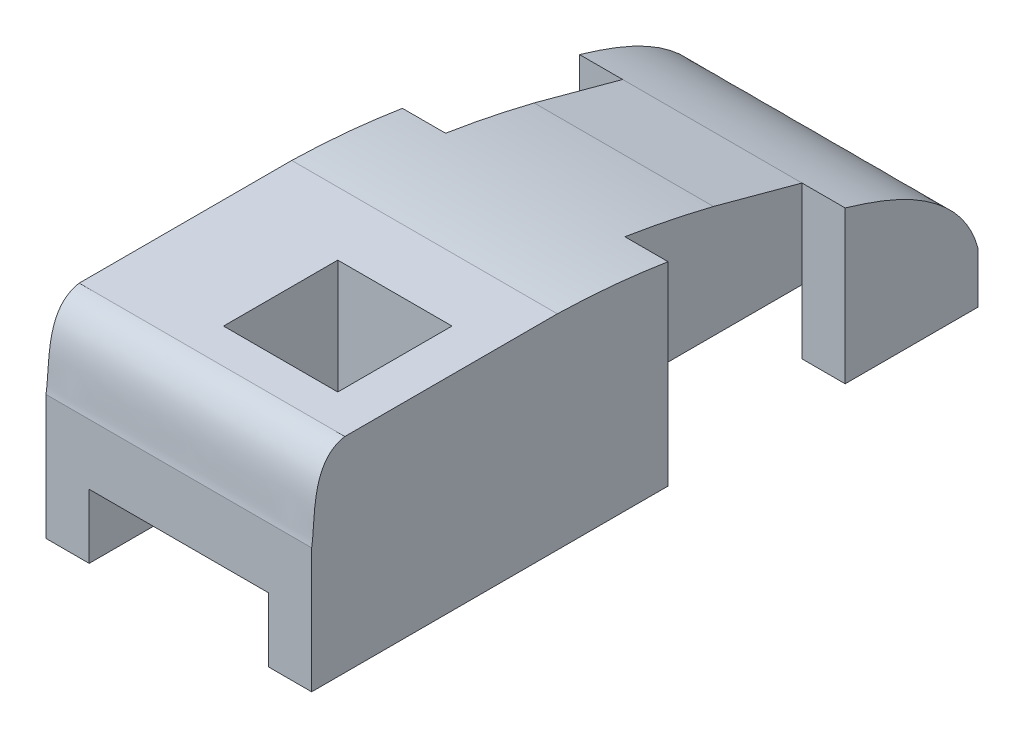
from build123d import *

# Parameters (mm, degrees)
SKETCH_1_W                = 100
SKETCH_1_H                = 185
EXTRUDE_1_DEPTH           = 100
SKETCH_2_W                = 100
SKETCH_2_H                = 3.8
CUT_EXTRUDE_1_DEPTH       = 155
CUT_EXTRUDE_2_DEPTH       = 155
SKETCH_4_W                = 25.5
SKETCH_4_H                = 25.5
CUT_EXTRUDE_3_DEPTH       = 79
SKETCH_6_W                = 89.706259743
SKETCH_6_H                = 10
SKETCH_6_W_2              = 10.293740257
CUT_EXTRUDE_4_DEPTH       = 146.107718609
CUT_EXTRUDE_5_DEPTH       = 169.985946161
CUT_EXTRUDE_5_DEPTH_BACK  = 169.985946161
SKETCH_7_W                = 20
SKETCH_7_H                = 3.8
EXTRUDE_4_DEPTH           = 160
SKETCH_10_W               = 16
SKETCH_10_H               = 1.8
CUT_EXTRUDE_6_DEPTH       = 155
SKETCH_13_W               = 20
SKETCH_13_H               = 175
CUT_EXTRUDE_7_DEPTH       = 143.515578096
SKETCH_14_W               = 175
SKETCH_14_H               = 50
CUT_EXTRUDE_8_DEPTH       = 149.849756466
SKETCH_15_W               = 60
SKETCH_15_H               = 10
CUT_EXTRUDE_9_DEPTH       = 108.660066877
SKETCH_16_W               = 60
SKETCH_16_H               = 14.5
CUT_EXTRUDE_10_DEPTH      = 108.660066877
CUT_EXTRUDE_11_DEPTH      = 111.381157812
CUT_EXTRUDE_21_DEPTH      = 162.400898529
CUT_EXTRUDE_21_DEPTH_BACK = 140.5
CUT_EXTRUDE_26_DEPTH      = 111.381157983
SKETCH_34_W               = 10
SKETCH_34_H               = 20
CUT_EXTRUDE_31_DEPTH      = 96.490523251
SKETCH_35_W               = 18.74373947
SKETCH_35_H               = 80.5
CUT_EXTRUDE_32_DEPTH      = 14
CUT_EXTRUDE_35_DEPTH      = 60
CUT_EXTRUDE_36_DEPTH      = 140.5
SKETCH_43_W               = 0.25
SKETCH_43_H               = 0.002112168
CUT_EXTRUDE_37_DEPTH      = 140.5
SKETCH_44_W               = 7.5
SKETCH_44_H               = 0.502112168
CUT_EXTRUDE_38_DEPTH      = 80.4999
SKETCH_45_W               = 9.75
SKETCH_45_H               = 20
SKETCH_45_W_2             = 9.75146362
CUT_EXTRUDE_39_DEPTH      = 96.490523251
SKETCH_46_W               = 0.24853638
SKETCH_46_H               = 20
SKETCH_46_W_2             = 0.25
EXTRUDE_5_DEPTH           = 31.697888
CUT_EXTRUDE_40_DEPTH      = 106.399537724
CUT_EXTRUDE_40_DEPTH_BACK = 106.399537724
SKETCH_54_W               = 25.5
SKETCH_54_H               = 0.5
CUT_EXTRUDE_41_DEPTH      = 29
SKETCH_55_W               = 26
SKETCH_55_H               = 26
EXTRUDE_6_DEPTH           = 29
SKETCH_56_W               = 25.8
SKETCH_56_H               = 25.8
CUT_EXTRUDE_42_DEPTH      = 29


with BuildPart() as part:
    # 草图1 → 凸台-拉伸1 (new body)
    with BuildSketch(Plane(origin=(0, 0, 0), x_dir=(1, 0, 0), z_dir=(0, 1, 0))):
        Rectangle(SKETCH_1_W, SKETCH_1_H)
    extrude(amount=EXTRUDE_1_DEPTH)

    # 草图2 → 切除-拉伸1 (cut)
    with BuildSketch(Plane.XY.offset(92.5)):
        with Locations((0, 1.9)):
            Rectangle(SKETCH_2_W, SKETCH_2_H)
    extrude(amount=-CUT_EXTRUDE_1_DEPTH, mode=Mode.SUBTRACT)

    # 草图3 → 切除-拉伸2 (cut)
    with BuildSketch(Plane.XY.offset(92.5)):
        with BuildLine():
            Line((-20, 3.8), (-3.51, 3.8))
            ThreePointArc((-3.51, 3.8), (-3.949598778, 3.901619975), (-4.3, 4.185860522))
            Line((-4.3, 4.185860522), (-9.371869735, 10.69267521))
            ThreePointArc((-9.371869735, 10.69267521), (-9.267749528, 11.143089764), (-8.9765156, 11.502112168))
            Line((-8.9765156, 11.502112168), (-4.5, 11.502112168))
            ThreePointArc((-4.5, 11.502112168), (-4.146446609, 11.648558777), (-4, 12.002112168))
            Line((-4, 12.002112168), (-4, 16.002112168))
            Line((-4, 16.002112168), (-20, 16.002112168))
            Line((-20, 16.002112168), (-20, 3.8))
        make_face()
        with BuildLine():
            ThreePointArc((4.3, 4.185860522), (3.949598778, 3.901619975), (3.51, 3.8))
            Line((3.51, 3.8), (20, 3.8))
            Line((20, 3.8), (20, 16.002112168))
            Line((20, 16.002112168), (4, 16.002112168))
            Line((4, 16.002112168), (4, 12.002112168))
            ThreePointArc((4, 12.002112168), (4.146446609, 11.648558777), (4.5, 11.502112168))
            Line((4.5, 11.502112168), (8.9765156, 11.502112168))
            ThreePointArc((8.9765156, 11.502112168), (9.426930154, 11.220838522), (9.371869735, 10.69267521))
            Line((9.371869735, 10.69267521), (4.3, 4.185860522))
        make_face()
    extrude(amount=-CUT_EXTRUDE_2_DEPTH, mode=Mode.SUBTRACT)

    # 草图4 → 切除-拉伸3 (cut)
    with BuildSketch(Plane(origin=(0, 100, 0), x_dir=(1, 0, 0), z_dir=(0, 1, 0))):
        with Locations((7.75, -50.25)):
            Rectangle(SKETCH_4_W, SKETCH_4_H)
    extrude(amount=-CUT_EXTRUDE_3_DEPTH, mode=Mode.SUBTRACT)

    # 草图6 → 切除-拉伸4 (cut, through all)
    with BuildSketch(Plane(origin=(0, 100, 0), x_dir=(1, 0, 0), z_dir=(0, 1, 0))):
        with Locations((5.146870128, 87.5)):
            Rectangle(SKETCH_6_W, SKETCH_6_H)
        with Locations((-44.853129872, 87.5)):
            Rectangle(SKETCH_6_W_2, SKETCH_6_H)
    extrude(amount=-CUT_EXTRUDE_4_DEPTH, mode=Mode.SUBTRACT)

    # 草图7 → 切除-拉伸5 (cut, two sides: drawn at the far end of the back side and taken through both)
    with BuildSketch(Plane.ZY.offset(50).offset(-CUT_EXTRUDE_5_DEPTH_BACK)):
        with Locations((-72.5, 1.9)):
            Rectangle(SKETCH_7_W, SKETCH_7_H)
    extrude(amount=CUT_EXTRUDE_5_DEPTH + CUT_EXTRUDE_5_DEPTH_BACK, mode=Mode.SUBTRACT)

    # 草图9 → 凸台-拉伸4 (add)
    with BuildSketch(Plane.XY.offset(92.5)):
        Polygon((-9.371869735, 10.69267521), (-9.371869735, 13.29267521), (-4, 13.29267521), (4, 13.29267521), (9.371869735, 13.29267521), (9.371869735, 10.69267521), align=None)
    extrude(amount=-EXTRUDE_4_DEPTH)

    # 草图10 → 切除-拉伸6 (cut)
    with BuildSketch(Plane.XY.offset(92.5)):
        with Locations((-12, 16.902112168)):
            Rectangle(SKETCH_10_W, SKETCH_10_H)
        Polygon((4, 16.002112168), (4, 17.802112168), (19.99853638, 17.802112168), (20, 16.002112168), align=None)
    extrude(amount=-CUT_EXTRUDE_6_DEPTH, mode=Mode.SUBTRACT)

    # 草图13 → 切除-拉伸7 (cut, through all)
    with BuildSketch(Plane.XZ.offset(-3.8)):
        with Locations((-40, 5)):
            Rectangle(SKETCH_13_W, SKETCH_13_H)
        with Locations((40, 5)):
            Rectangle(SKETCH_13_W, SKETCH_13_H)
    extrude(amount=-CUT_EXTRUDE_7_DEPTH, mode=Mode.SUBTRACT)

    # 草图14 → 切除-拉伸8 (cut, through all)
    with BuildSketch(Plane(origin=(30, 0, 0), x_dir=(0, 0, -1), z_dir=(1, 0, 0))):
        with Locations((-5, 75)):
            Rectangle(SKETCH_14_W, SKETCH_14_H)
    extrude(amount=-CUT_EXTRUDE_8_DEPTH, mode=Mode.SUBTRACT)

    # 草图15 → 切除-拉伸9 (cut, through all)
    with BuildSketch(Plane.XZ.offset(-3.8)):
        with Locations((0, -77.5)):
            Rectangle(SKETCH_15_W, SKETCH_15_H)
    extrude(amount=-CUT_EXTRUDE_9_DEPTH, mode=Mode.SUBTRACT)

    # 草图16 → 切除-拉伸10 (cut, through all)
    with BuildSketch(Plane(origin=(0, 50, 0), x_dir=(1, 0, 0), z_dir=(0, 1, 0))):
        with Locations((0, -85.25)):
            Rectangle(SKETCH_16_W, SKETCH_16_H)
    extrude(amount=-CUT_EXTRUDE_10_DEPTH, mode=Mode.SUBTRACT)

    # 草图17 → 切除-拉伸11 (cut, through all)
    with BuildSketch(Plane(origin=(30, 0, 0), x_dir=(0, 0, -1), z_dir=(1, 0, 0))):
        with BuildLine():
            Line((72.5, 50), (-22.5, 50))
            add(Edge.make_bspline(
                [(-22.5, 50), (-9.330669895, 49.706144403), (11.085821801, 46.827148239), (38.239751221, 39.498978447), (59.688603115, 33.272875951), (70.679662454, 22.295526596), (72.5, 15.311284203)],
                knots=[0, 0, 0, 0, 0.374533404, 0.581855131, 0.802431491, 1, 1, 1, 1], degree=3))
            Line((72.5, 15.311284203), (72.5, 50))
        make_face()
    extrude(amount=-CUT_EXTRUDE_11_DEPTH, mode=Mode.SUBTRACT)

    # 草图24 → 切除-拉伸21 (cut, two sides: drawn at the far end of the back side and taken through both)
    with BuildSketch(Plane.XY.offset(78).offset(-CUT_EXTRUDE_21_DEPTH_BACK)):
        with BuildLine():
            Line((9.371869735, 11.309008937), (9.371869735, 10.69267521))
            ThreePointArc((9.371869735, 10.69267521), (9.477785695, 11.000842073), (9.371869735, 11.309008937))
        make_face()
    extrude(amount=CUT_EXTRUDE_21_DEPTH + CUT_EXTRUDE_21_DEPTH_BACK, mode=Mode.SUBTRACT)

    # 草图28 → 切除-拉伸26 (cut, through all)
    with BuildSketch(Plane(origin=(30, 0, 0), x_dir=(0, 0, -1), z_dir=(1, 0, 0))):
        with BuildLine():
            Line((-70.5, 50), (-78, 50))
            Line((-78, 50), (-78, 31.982866201))
            add(Edge.make_bspline(
                [(-70.5, 50), (-78.410932033, 48.656434308), (-77.0737544, 36.843285786), (-78, 31.982866201)],
                knots=[0, 0, 0, 0, 1, 1, 1, 1], degree=3))
        make_face()
    extrude(amount=-CUT_EXTRUDE_26_DEPTH, mode=Mode.SUBTRACT)

    # 草图34 → 切除-拉伸31 (cut, through all)
    with BuildSketch(Plane.XZ.offset(-3.8)):
        with Locations((-25, -32.5)):
            Rectangle(SKETCH_34_W, SKETCH_34_H)
        with Locations((25, -32.5)):
            Rectangle(SKETCH_34_W, SKETCH_34_H)
    extrude(amount=-CUT_EXTRUDE_31_DEPTH, mode=Mode.SUBTRACT)

    # 草图35 → 切除-拉伸32 (cut)
    with BuildSketch(Plane.XZ.offset(-3.8)):
        with Locations((0, 37.75)):
            Rectangle(SKETCH_35_W, SKETCH_35_H)
    extrude(amount=-CUT_EXTRUDE_32_DEPTH, mode=Mode.SUBTRACT)

    # 草图40 → 切除-拉伸35 (cut)
    with BuildSketch(Plane.XY.offset(-2.5)):
        Polygon((4, 13.29267521), (4, 17.8), (3.75, 17.8), (3.75, 12.79267521), (9.371869735, 12.79267521), (9.371869735, 13.29267521), align=None)
        Polygon((-3.75, 17.8), (-4, 17.8), (-4, 13.29267521), (-9.371869735, 13.29267521), (-9.371869735, 12.79267521), (-3.75, 12.79267521), align=None)
    extrude(amount=-CUT_EXTRUDE_35_DEPTH, mode=Mode.SUBTRACT)

    # 草图41 → 切除-拉伸36 (cut)
    with BuildSketch(Plane.XY.offset(78)):
        Polygon((-3.75, 18.302112168), (-20.25, 18.302112168), (-20.25, 3.8), (-20, 3.8), (-20, 17.802112168), (-3.75, 17.802112168), align=None)
        Polygon((3.75, 18.302112168), (3.75, 17.802112168), (19.99853638, 17.802112168), (19.99853638, 3.8), (20.24853638, 3.8), (20.24853638, 18.302112168), align=None)
    extrude(amount=-CUT_EXTRUDE_36_DEPTH, mode=Mode.SUBTRACT)

    # 草图43 → 切除-拉伸37 (cut)
    with BuildSketch(Plane.XY.offset(78)):
        with Locations((-3.875, 17.801056084)):
            Rectangle(SKETCH_43_W, SKETCH_43_H)
        with Locations((3.875, 17.801056084)):
            Rectangle(SKETCH_43_W, SKETCH_43_H)
    extrude(amount=-CUT_EXTRUDE_37_DEPTH, mode=Mode.SUBTRACT)

    # 草图44 → 切除-拉伸38 (cut)
    with BuildSketch(Plane.XY.offset(78)):
        with Locations((0, 18.051056084)):
            Rectangle(SKETCH_44_W, SKETCH_44_H)
    extrude(amount=-CUT_EXTRUDE_38_DEPTH, mode=Mode.SUBTRACT)

    # 草图45 → 切除-拉伸39 (cut, through all)
    with BuildSketch(Plane.XZ.offset(-3.8)):
        with Locations((-25.125, -12.5)):
            Rectangle(SKETCH_45_W, SKETCH_45_H)
        with Locations((25.12426819, -12.5)):
            Rectangle(SKETCH_45_W_2, SKETCH_45_H)
    extrude(amount=-CUT_EXTRUDE_39_DEPTH, mode=Mode.SUBTRACT)

    # 草图46 → 凸台-拉伸5 (add, through all)
    with BuildSketch(Plane.XZ.offset(-18.302112168)):
        with Locations((20.12426819, -32.5)):
            Rectangle(SKETCH_46_W, SKETCH_46_H)
        with Locations((-20.125, -32.5)):
            Rectangle(SKETCH_46_W_2, SKETCH_46_H)
    extrude(amount=-EXTRUDE_5_DEPTH)

    # 草图47 → 切除-拉伸40 (cut, two sides: drawn at the far end of the back side and taken through both)
    with BuildSketch(Plane.ZY.offset(20.25).offset(-CUT_EXTRUDE_40_DEPTH_BACK)):
        Polygon((-42.5, 38.203961841), (-22.5, 43.618048783), (-22.5, 50), (-42.5, 50), align=None)
    extrude(amount=CUT_EXTRUDE_40_DEPTH + CUT_EXTRUDE_40_DEPTH_BACK, mode=Mode.SUBTRACT)

    # 草图54 → 切除-拉伸41 (cut)
    with BuildSketch(Plane(origin=(0, 50, 0), x_dir=(1, 0, 0), z_dir=(0, 1, 0))):
        with Locations((7.75, -37.25)):
            Rectangle(SKETCH_54_W, SKETCH_54_H)
        Polygon((-5, -63), (-5, -37.5), (-5, -37), (-5.5, -37), (-5.5, -63), align=None)
    extrude(amount=-CUT_EXTRUDE_41_DEPTH, mode=Mode.SUBTRACT)

    # 草图55 → 凸台-拉伸6 (add)
    with BuildSketch(Plane(origin=(0, 50, 0), x_dir=(1, 0, 0), z_dir=(0, 1, 0))):
        with Locations((7.5, -50)):
            Rectangle(SKETCH_55_W, SKETCH_55_H)
    extrude(amount=-EXTRUDE_6_DEPTH)

    # 草图56 → 切除-拉伸42 (cut)
    with BuildSketch(Plane(origin=(0, 50, 0), x_dir=(1, 0, 0), z_dir=(0, 1, 0))):
        with Locations((7.6, -49.7)):
            Rectangle(SKETCH_56_W, SKETCH_56_H)
    extrude(amount=-CUT_EXTRUDE_42_DEPTH, mode=Mode.SUBTRACT)


solid = part.part
